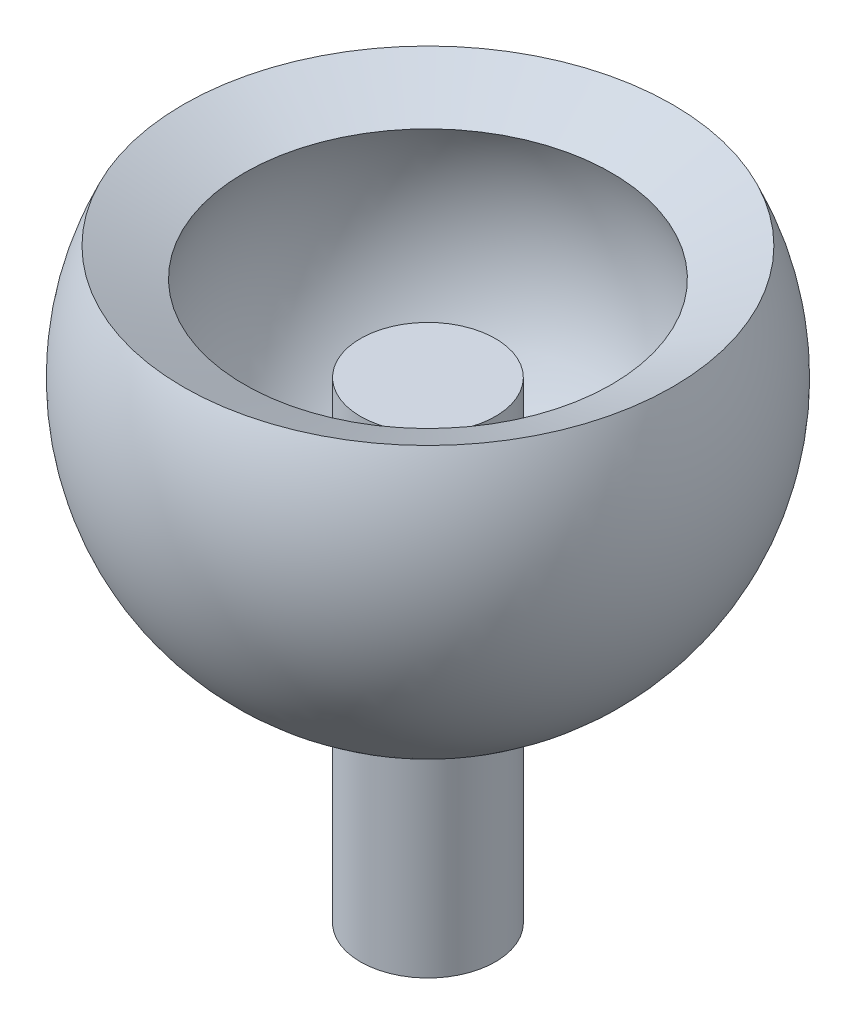
from build123d import *

# Parameters (mm, degrees)
ESQUISSE2_R        = 2
BOSS_EXTRU_1_DEPTH = 14


with BuildPart() as part:
    # Esquisse1 → Révolution1 (revolve)
    with BuildSketch(Plane.XY, mode=Mode.PRIVATE) as r_volution1_sk:
        with BuildLine():
            Line((-7.250462296, 3.380946094), (-5.437846722, 2.53570957))
            ThreePointArc((-5.437846722, 2.53570957), (-5.060348675, -3.22379765), (0, -6))
            Line((0, -6), (0, -8))
            ThreePointArc((0, -8), (-6.747131567, -4.298396867), (-7.250462296, 3.380946094))
        make_face()
    revolve(r_volution1_sk.sketch.rotate(Axis((0, 0, 0), (0, -1, 0)), 270), axis=Axis((0, 0, 0), (0, -1, 0)))

    # Esquisse2 → Boss.-Extru.1 (add)
    with BuildSketch(Plane(origin=(0, 0, 0), x_dir=(1, 0, 0), z_dir=(0, 1, 0))):
        with Locations(Location((0, 0, 0), (0, 0, 270))):
            Circle(ESQUISSE2_R)
    extrude(amount=-BOSS_EXTRU_1_DEPTH)


solid = part.part
